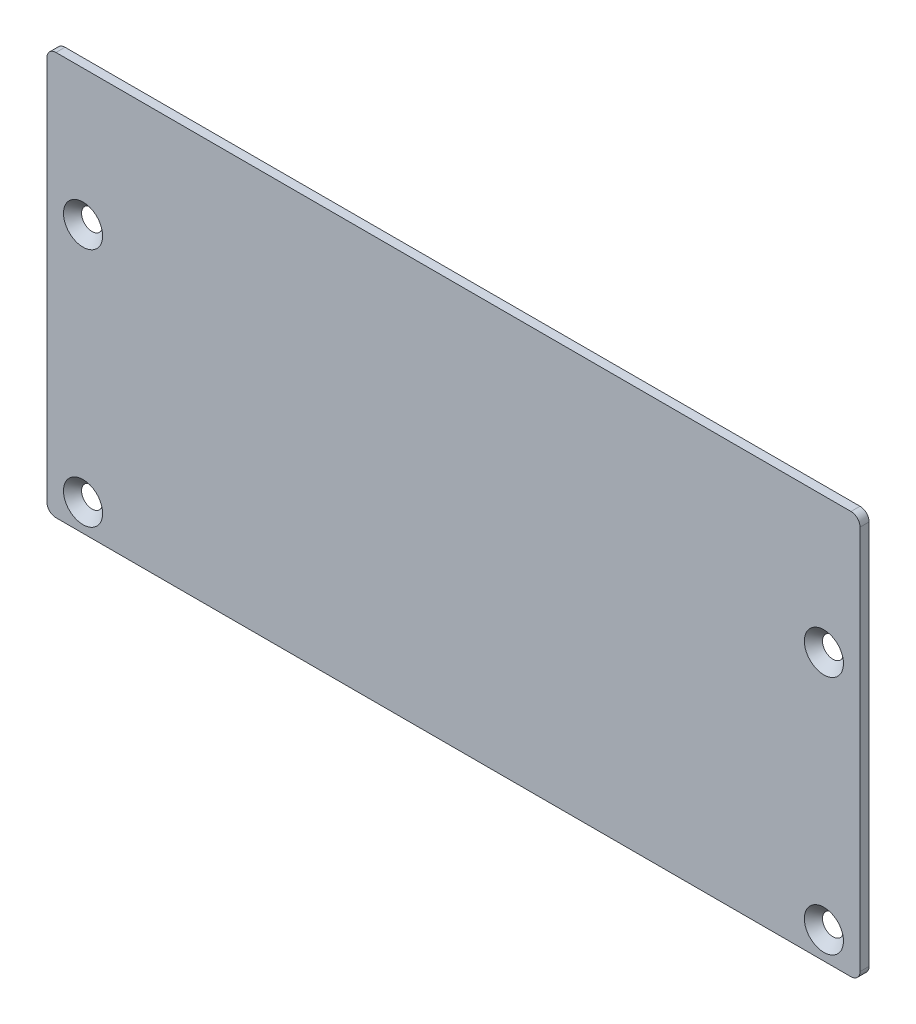
from build123d import *

# Parameters (mm, degrees)
SKETCH2_W                                    = 114.3
SKETCH2_H                                    = 56.642
BOSS_EXTRUDE1_DEPTH                          = 1.27
CSK_FOR_M2_5_COUNTERSUNK_FLAT_HEAD_S_2_COUNT = 2
CSK_FOR_M2_5_COUNTERSUNK_FLAT_HEAD_S_2_PITCH = 33.782
CSK_FOR_M2_5_COUNTERSUNK_FLAT_HEAD_S_3_COUNT = 2
CSK_FOR_M2_5_COUNTERSUNK_FLAT_HEAD_S_3_PITCH = 109.482250269
CSK_FOR_M2_5_COUNTERSUNK_FLAT_HEAD_S_4_COUNT = 2
CSK_FOR_M2_5_COUNTERSUNK_FLAT_HEAD_S_4_PITCH = 104.14
FILLET1_R                                    = 1.27


with BuildPart() as part:
    # Sketch2 → Boss-Extrude1 (new body)
    with BuildSketch(Plane.XY):
        with Locations((32.084210526, 9.700699248)):
            Rectangle(SKETCH2_W, SKETCH2_H)
    extrude(amount=BOSS_EXTRUDE1_DEPTH)

    # Sketch6 → CSK for M2.5 Countersunk Flat Head Screw1 (revolve, cut)
    with BuildSketch(Plane(origin=(-19.985789474, 18.971699248, 1.27), x_dir=(0, -1, 0), z_dir=(1, 0, 0))):
        Polygon((0, 0), (0, 1.27), (1.45, 1.27), (1.45, 1.3), (2.75, 0), align=None)
    csk_for_m2_5_countersunk_flat_head_screw = revolve(axis=Axis((-19.985789474, 18.971699248, 7.62), (0, 0, -1)), mode=Mode.SUBTRACT)

    # CSK for M2.5 Countersunk Flat Head S 2: CSK for M2.5 Countersunk Flat Head Screw1 ×2
    with Locations(*[(0, -i * CSK_FOR_M2_5_COUNTERSUNK_FLAT_HEAD_S_2_PITCH, 0) for i in range(1, CSK_FOR_M2_5_COUNTERSUNK_FLAT_HEAD_S_2_COUNT)]):
        add(csk_for_m2_5_countersunk_flat_head_screw, mode=Mode.SUBTRACT)

    # CSK for M2.5 Countersunk Flat Head S 3: CSK for M2.5 Countersunk Flat Head Screw1 ×2
    with Locations(*[Vector(0.9512044166426011, -0.3085614327157706, 0) * (i * CSK_FOR_M2_5_COUNTERSUNK_FLAT_HEAD_S_3_PITCH) for i in range(1, CSK_FOR_M2_5_COUNTERSUNK_FLAT_HEAD_S_3_COUNT)]):
        add(csk_for_m2_5_countersunk_flat_head_screw, mode=Mode.SUBTRACT)

    # CSK for M2.5 Countersunk Flat Head S 4: CSK for M2.5 Countersunk Flat Head Screw1 ×2
    with Locations(*[(i * CSK_FOR_M2_5_COUNTERSUNK_FLAT_HEAD_S_4_PITCH, 0, 0) for i in range(1, CSK_FOR_M2_5_COUNTERSUNK_FLAT_HEAD_S_4_COUNT)]):
        add(csk_for_m2_5_countersunk_flat_head_screw, mode=Mode.SUBTRACT)

    # Fillet1
    fillet1_edges = [part.edges().sort_by_distance(p)[0] for p in [
        (-25.065789474, 38.021699248, 0.635),
        (89.234210526, 38.021699248, 0.635),
        (89.234210526, -18.620300752, 0.635),
        (-25.065789474, -18.620300752, 0.635),
    ]]
    fillet(fillet1_edges, radius=FILLET1_R)


solid = part.part
